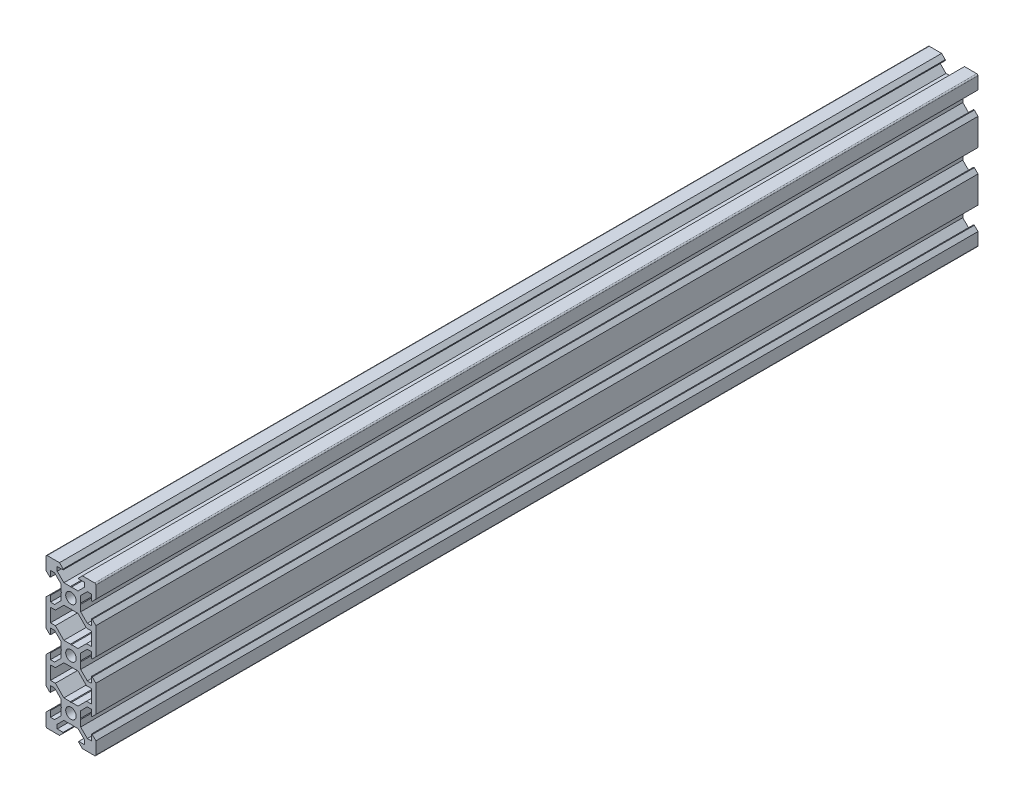
from build123d import *

# Parameters (mm, degrees)
BOSS_EXTRU_1_DEPTH = 353.7


with BuildPart() as part:
    # Esquisse1 → Boss.-Extru.1 (new body)
    with BuildSketch(Plane.XY):
        with BuildLine():
            Line((-9.5, 10), (-4.58, 10))
            Line((-4.58, 10), (-3.125, 8.545))
            Line((-3.125, 8.545), (-3.125, 8.2))
            Line((-3.125, 8.2), (-5.5, 8.2))
            Line((-5.5, 8.2), (-5.5, 6.560660172))
            Line((-5.5, 6.560660172), (-2.839339828, 3.9))
            Line((-2.839339828, 3.9), (-0.21, 3.9))
            Line((-0.21, 3.9), (0, 3.69))
            Line((0, 3.69), (0, 2.1))
            ThreePointArc((0, 2.1), (-2.1, 0), (0, -2.1))
            Line((0, -2.1), (0, -3.69))
            Line((0, -3.69), (-0.21, -3.9))
            Line((-0.21, -3.9), (-2.839339828, -3.9))
            Line((-2.839339828, -3.9), (-6.239339828, -7.3))
            Line((-6.239339828, -7.3), (-8.2, -7.3))
            Line((-8.2, -7.3), (-8.2, -12.7))
            Line((-8.2, -12.7), (-6.239339828, -12.7))
            Line((-6.239339828, -12.7), (-2.839339828, -16.1))
            Line((-2.839339828, -16.1), (-0.21, -16.1))
            Line((-0.21, -16.1), (0, -16.31))
            Line((0, -16.31), (0, -17.9))
            ThreePointArc((0, -17.9), (-2.1, -20), (0, -22.1))
            Line((0, -22.1), (0, -23.69))
            Line((0, -23.69), (-0.21, -23.9))
            Line((-0.21, -23.9), (-2.839339828, -23.9))
            Line((-2.839339828, -23.9), (-6.239339828, -27.3))
            Line((-6.239339828, -27.3), (-8.2, -27.3))
            Line((-8.2, -27.3), (-8.2, -32.7))
            Line((-8.2, -32.7), (-6.239339828, -32.7))
            Line((-6.239339828, -32.7), (-2.839339828, -36.1))
            Line((-2.839339828, -36.1), (-0.21, -36.1))
            Line((-0.21, -36.1), (0, -36.31))
            Line((0, -36.31), (0, -37.9))
            ThreePointArc((0, -37.9), (-2.1, -40), (0, -42.1))
            Line((0, -42.1), (0, -43.69))
            Line((0, -43.69), (-0.21, -43.9))
            Line((-0.21, -43.9), (-2.839339828, -43.9))
            Line((-2.839339828, -43.9), (-5.5, -46.560660172))
            Line((-5.5, -46.560660172), (-5.5, -48.2))
            Line((-5.5, -48.2), (-3.125, -48.2))
            Line((-3.125, -48.2), (-3.125, -48.545))
            Line((-3.125, -48.545), (-4.58, -50))
            Line((-4.58, -50), (-9.5, -50))
            ThreePointArc((-9.5, -50), (-9.853553391, -49.853553391), (-10, -49.5))
            Line((-10, -49.5), (-10, -44.58))
            Line((-10, -44.58), (-8.545, -43.125))
            Line((-8.545, -43.125), (-8.2, -43.125))
            Line((-8.2, -43.125), (-8.2, -45.5))
            Line((-8.2, -45.5), (-6.560660172, -45.5))
            Line((-6.560660172, -45.5), (-3.9, -42.839339828))
            Line((-3.9, -42.839339828), (-3.9, -40.21))
            Line((-3.9, -40.21), (-3.69, -40))
            Line((-3.69, -40), (-3.9, -39.79))
            Line((-3.9, -39.79), (-3.9, -37.160660172))
            Line((-3.9, -37.160660172), (-6.560660172, -34.5))
            Line((-6.560660172, -34.5), (-8.2, -34.5))
            Line((-8.2, -34.5), (-8.2, -36.875))
            Line((-8.2, -36.875), (-8.545, -36.875))
            Line((-8.545, -36.875), (-10, -35.42))
            Line((-10, -35.42), (-10, -24.58))
            Line((-10, -24.58), (-8.545, -23.125))
            Line((-8.545, -23.125), (-8.2, -23.125))
            Line((-8.2, -23.125), (-8.2, -25.5))
            Line((-8.2, -25.5), (-6.560660172, -25.5))
            Line((-6.560660172, -25.5), (-3.9, -22.839339828))
            Line((-3.9, -22.839339828), (-3.9, -20.21))
            Line((-3.9, -20.21), (-3.69, -20))
            Line((-3.69, -20), (-3.9, -19.79))
            Line((-3.9, -19.79), (-3.9, -17.160660172))
            Line((-3.9, -17.160660172), (-6.560660172, -14.5))
            Line((-6.560660172, -14.5), (-8.2, -14.5))
            Line((-8.2, -14.5), (-8.2, -16.875))
            Line((-8.2, -16.875), (-8.545, -16.875))
            Line((-8.545, -16.875), (-10, -15.42))
            Line((-10, -15.42), (-10, -4.58))
            Line((-10, -4.58), (-8.545, -3.125))
            Line((-8.545, -3.125), (-8.2, -3.125))
            Line((-8.2, -3.125), (-8.2, -5.5))
            Line((-8.2, -5.5), (-6.560660172, -5.5))
            Line((-6.560660172, -5.5), (-3.9, -2.839339828))
            Line((-3.9, -2.839339828), (-3.9, -0.21))
            Line((-3.9, -0.21), (-3.69, 0))
            Line((-3.69, 0), (-3.9, 0.21))
            Line((-3.9, 0.21), (-3.9, 2.839339828))
            Line((-3.9, 2.839339828), (-6.560660172, 5.5))
            Line((-6.560660172, 5.5), (-8.2, 5.5))
            Line((-8.2, 5.5), (-8.2, 3.125))
            Line((-8.2, 3.125), (-8.545, 3.125))
            Line((-8.545, 3.125), (-10, 4.58))
            Line((-10, 4.58), (-10, 9.5))
            ThreePointArc((-10, 9.5), (-9.853553391, 9.853553391), (-9.5, 10))
        make_face()
    boss_extru_1 = extrude(amount=BOSS_EXTRU_1_DEPTH)

    # Symétrie1: Boss.-Extru.1 across plane
    add(boss_extru_1.mirror(Plane(origin=(0, 3.69, 353.7), x_dir=(0, 0, 1), z_dir=(-1, 0, 0))))


solid = part.part
